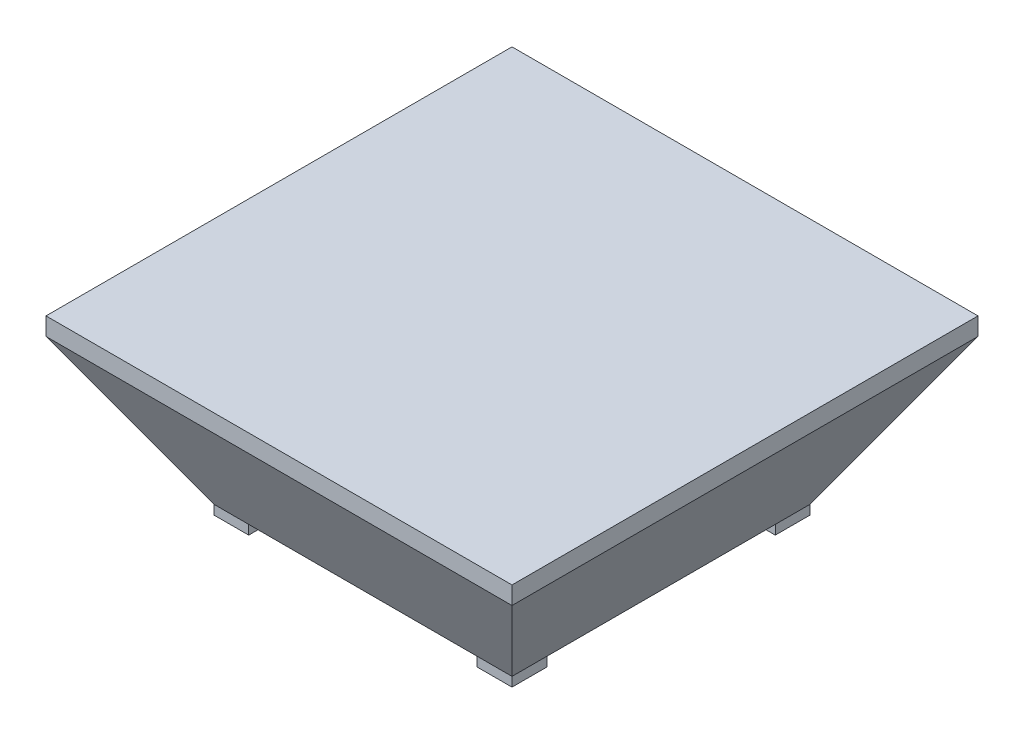
from build123d import *

# Parameters (mm, degrees)
CROQUIS1_W              = 1000
CROQUIS1_H              = 1000
SALIENTE_EXTRUIR1_DEPTH = 350
CHAFL_N1_SIZE           = 180
CHAFL_N1_SIZE2          = 311.769145362
CROQUIS2_W              = 75
CROQUIS2_H              = 75
SALIENTE_EXTRUIR2_DEPTH = 20


with BuildPart() as part:
    # Croquis1 → Saliente-Extruir1 (new body)
    with BuildSketch(Plane(origin=(0, 0, 0), x_dir=(1, 0, 0), z_dir=(0, 1, 0))):
        Rectangle(CROQUIS1_W, CROQUIS1_H)
    extrude(amount=SALIENTE_EXTRUIR1_DEPTH)

    # Chaflán1
    chafl_n1_edges = [part.edges().sort_by_distance(p)[0] for p in [
        (0, 0, -500),
        (500, 0, 0),
        (0, 0, 500),
        (-500, 0, 0),
    ]]
    chafl_n1_side = [part.faces().sort_by_distance(p)[0] for p in [
        (0, 0, 0),
    ]]
    chamfer(chafl_n1_edges, length=CHAFL_N1_SIZE, length2=CHAFL_N1_SIZE2, reference=chafl_n1_side[0])

    # Croquis2 → Saliente-Extruir2 (add)
    with BuildSketch(Plane.XZ):
        with Locations((-282.5, 282.5)):
            Rectangle(CROQUIS2_W, CROQUIS2_H)
        with Locations((282.5, 282.5)):
            Rectangle(CROQUIS2_W, CROQUIS2_H)
        with Locations((282.5, -282.5)):
            Rectangle(CROQUIS2_W, CROQUIS2_H)
        with Locations((-282.5, -282.5)):
            Rectangle(CROQUIS2_W, CROQUIS2_H)
    extrude(amount=SALIENTE_EXTRUIR2_DEPTH)


solid = part.part
